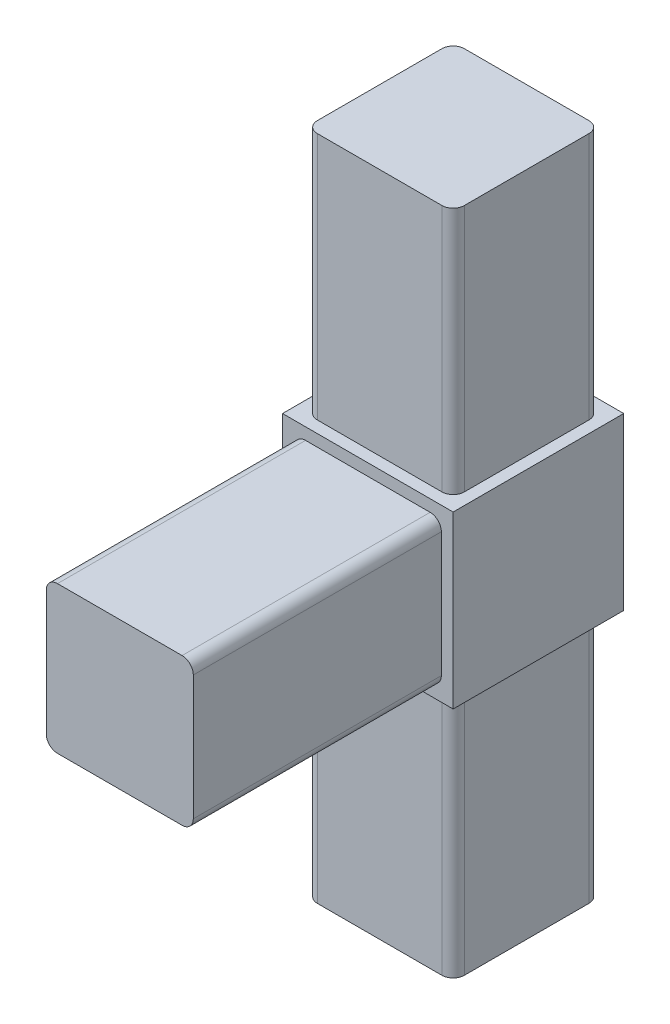
from build123d import *

# Parameters (mm, degrees)
SKETCH1_W           = 16.637
SKETCH1_H           = 16.637
BOSS_EXTRUDE1_DEPTH = 28.067
SKETCH2_W           = 19.304
SKETCH2_H           = 19.304
BOSS_EXTRUDE2_DEPTH = 19.304
SKETCH3_W           = 16.637
SKETCH3_H           = 16.637
BOSS_EXTRUDE3_DEPTH = 28.067
SKETCH5_W           = 16.637
SKETCH5_H           = 16.637
BOSS_EXTRUDE4_DEPTH = 28.067
FILLET1_R           = 1.27


with BuildPart() as part:
    # Sketch1 → Boss-Extrude1 (new body)
    with BuildSketch(Plane(origin=(0, 0, 0), x_dir=(1, 0, 0), z_dir=(0, 1, 0))):
        Rectangle(SKETCH1_W, SKETCH1_H)
    extrude(amount=BOSS_EXTRUDE1_DEPTH)

    # Sketch2 → Boss-Extrude2 (add)
    with BuildSketch(Plane(origin=(0, 28.067, 0), x_dir=(1, 0, 0), z_dir=(0, 1, 0))):
        Rectangle(SKETCH2_W, SKETCH2_H)
    extrude(amount=BOSS_EXTRUDE2_DEPTH)

    # Sketch3 → Boss-Extrude3 (add)
    with BuildSketch(Plane.XY.offset(9.652)):
        with Locations((0, 37.719)):
            Rectangle(SKETCH3_W, SKETCH3_H)
    extrude(amount=BOSS_EXTRUDE3_DEPTH)

    # Sketch5 → Boss-Extrude4 (add)
    with BuildSketch(Plane(origin=(0, 47.371, 0), x_dir=(1, 0, 0), z_dir=(0, 1, 0))):
        Rectangle(SKETCH5_W, SKETCH5_H)
    extrude(amount=BOSS_EXTRUDE4_DEPTH)

    # Fillet1
    fillet1_edges = [part.edges().sort_by_distance(p)[0] for p in [
        (8.3185, 29.4005, 23.6855),
        (8.3185, 46.0375, 23.6855),
        (-8.3185, 46.0375, 23.6855),
        (-8.3185, 29.4005, 23.6855),
        (8.3185, 61.4045, 8.3185),
        (8.3185, 61.4045, -8.3185),
        (-8.3185, 61.4045, -8.3185),
        (-8.3185, 61.4045, 8.3185),
        (8.3185, 14.0335, 8.3185),
        (-8.3185, 14.0335, 8.3185),
        (-8.3185, 14.0335, -8.3185),
        (8.3185, 14.0335, -8.3185),
    ]]
    fillet(fillet1_edges, radius=FILLET1_R)


solid = part.part
